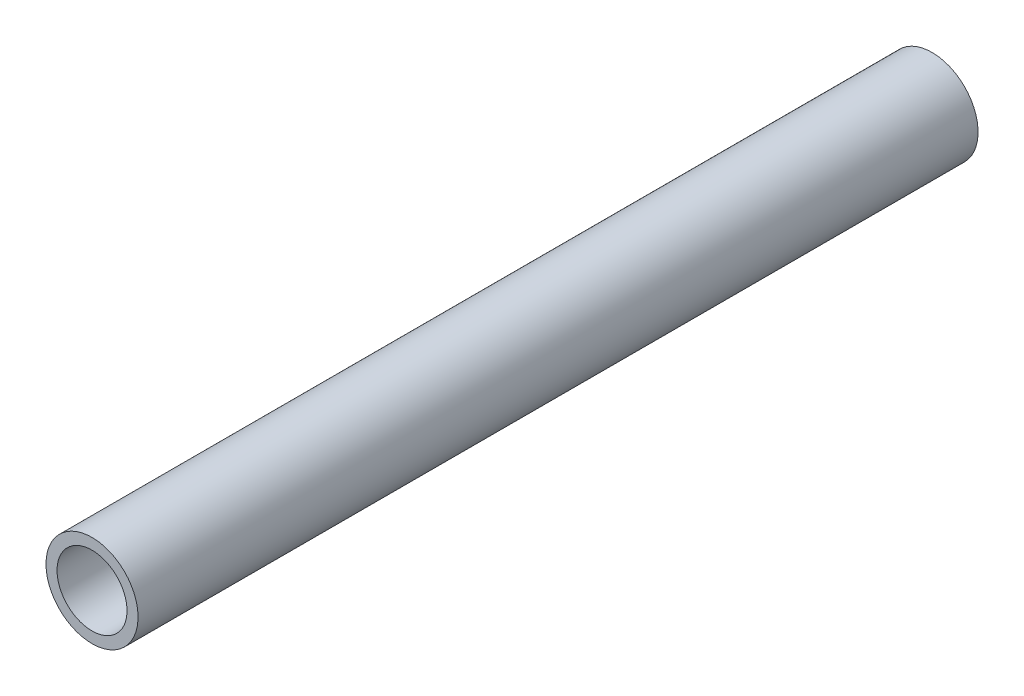
from build123d import *

# Parameters (mm, degrees)
SKETCH1_R           = 16.7005
SKETCH1_R_2         = 12.7
BOSS_EXTRUDE1_DEPTH = 304.8


with BuildPart() as part:
    # Sketch1 → Boss-Extrude1 (new body)
    with BuildSketch(Plane.XY):
        with Locations(Location((0, 0, 0), (0, 0, 180))):
            Circle(SKETCH1_R)
        with Locations(Location((0, 0, 0), (0, 0, 180))):
            Circle(SKETCH1_R_2, mode=Mode.SUBTRACT)
    extrude(amount=BOSS_EXTRUDE1_DEPTH)


solid = part.part
